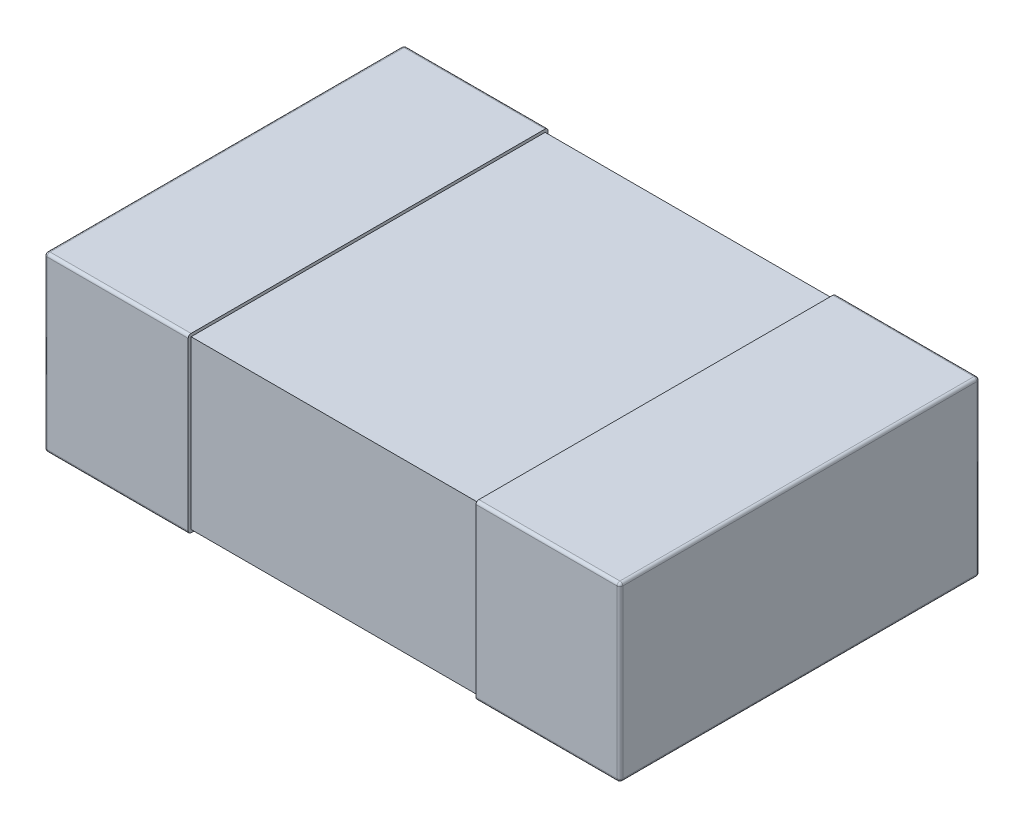
from build123d import *

# Parameters (mm, degrees)
SKETCH1_W            = 0.5
SKETCH1_H            = 1.25
THICKNESS_DEPTH      = 0.3
FILLET1_R            = 0.01
SKETCH2_W            = 1.23
SKETCH2_H            = 0.58
BOSS_EXTRUDE2_DEPTH  = 0.5
FILLET1_OF_MIRROR3_R = 0.01


with BuildPart() as part:
    # Sketch1 → THICKNESS (new, symmetric)
    with BuildSketch(Plane(origin=(0, 0, 0), x_dir=(1, 0, 0), z_dir=(0, 1, 0))):
        with Locations((-0.75, 0)):
            Rectangle(SKETCH1_W, SKETCH1_H)
    thickness = extrude(amount=THICKNESS_DEPTH, both=True)

    # Fillet1
    fillet1_edges = [part.edges().sort_by_distance(p)[0] for p in [
        (-0.75, 0.3, -0.625),
        (-1, 0.3, 0),
        (-0.75, -0.3, -0.625),
        (-0.75, -0.3, 0.625),
        (-1, -0.3, 0),
        (-0.75, 0.3, 0.625),
        (-1, 0, -0.625),
        (-1, 0, 0.625),
    ]]
    fillet(fillet1_edges, radius=FILLET1_R)

    # Sketch2 → Boss-Extrude2 (add)
    with BuildSketch(Plane(origin=(0, 0, 0), x_dir=(0, 0, -1), z_dir=(1, 0, 0))):
        Rectangle(SKETCH2_W, SKETCH2_H)
    boss_extrude2 = extrude(amount=-BOSS_EXTRUDE2_DEPTH)

    # Mirror3: THICKNESS, Boss-Extrude2 across plane
    add(thickness.mirror(Plane(origin=(0, 0, 0), x_dir=(0, 0, 1), z_dir=(1, 0, 0))))
    add(boss_extrude2.mirror(Plane(origin=(0, 0, 0), x_dir=(0, 0, 1), z_dir=(1, 0, 0))))

    # Fillet1 of Mirror3
    fillet1_of_mirror3_edges = [part.edges().sort_by_distance(p)[0] for p in [
        (0.75, 0.3, -0.625),
        (1, 0.3, 0),
        (0.75, -0.3, -0.625),
        (0.75, -0.3, 0.625),
        (1, -0.3, 0),
        (0.75, 0.3, 0.625),
        (1, 0, -0.625),
        (1, 0, 0.625),
    ]]
    fillet(fillet1_of_mirror3_edges, radius=FILLET1_OF_MIRROR3_R)


solid = part.part
